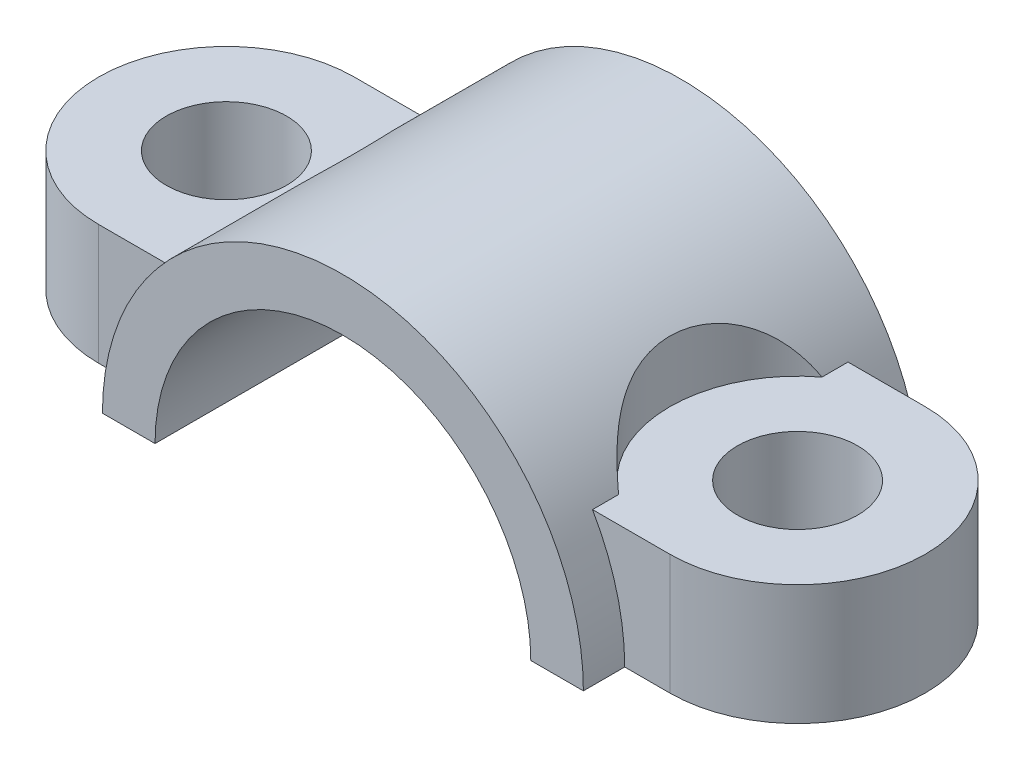
from build123d import *

# Parameters (mm, degrees)
SKETCH_4_R          = 8.5
SKETCH_4_R_2        = 4
EXTRUDE_1_DEPTH     = 8
EXTRUDE_1_2_DEPTH   = 8
SKETCH_5_R          = 12.5
CUT_EXTRUDE_1_DEPTH = 10
EXTRUDE_3_DEPTH     = 11.25
SKETCH_7_R          = 8.5
CUT_EXTRUDE_2_DEPTH = 31.770318642
EXTRUDE_START       = -8
EXTRUDE_4_DEPTH     = 8
SKETCH_9_R          = 4
CUT_EXTRUDE_3_DEPTH = 31.770318642


with BuildPart() as part:
    # 草图4 → 凸台-拉伸1 (new body)
    with BuildSketch(Plane(origin=(0, 0, 0), x_dir=(1, 0, 0), z_dir=(0, 1, 0))):
        with Locations(Location((-19, 0, 0), (0, 0, 270))):
            Circle(SKETCH_4_R)
        with Locations(Location((-19, 0, 0), (0, 0, 270))):
            Circle(SKETCH_4_R_2, mode=Mode.SUBTRACT)
    extrude(amount=EXTRUDE_1_DEPTH)


with BuildPart() as body_2:
    # 草图4 → Extrude 1 2 (new body)
    with BuildSketch(Plane(origin=(0, 0, 0), x_dir=(1, 0, 0), z_dir=(0, 1, 0))):
        with Locations(Location((19, 0, 0), (0, 0, 90))):
            Circle(SKETCH_4_R)
        with Locations(Location((19, 0, 0), (0, 0, 90))):
            Circle(SKETCH_4_R_2, mode=Mode.SUBTRACT)
    extrude(amount=EXTRUDE_1_2_DEPTH)


with BuildPart() as cut_extrude_1_tool:
    # 草图5 → 切除-拉伸1 (new, symmetric)
    with BuildSketch(Plane.XY):
        Circle(SKETCH_5_R)
    extrude(amount=CUT_EXTRUDE_1_DEPTH, both=True)


with BuildPart() as part_1:
    add(part.part)

    # 切除-拉伸1: cut by cut_extrude_1_tool
    add(cut_extrude_1_tool.part, mode=Mode.SUBTRACT)



with BuildPart() as body_2_1:
    add(body_2.part)

    # 切除-拉伸1: cut by cut_extrude_1_tool
    add(cut_extrude_1_tool.part, mode=Mode.SUBTRACT)


with BuildPart() as part_2:
    add(part_1.part)

    add(body_2_1.part)  # 凸台-拉伸3 merges body 2
    # 草图6 → 凸台-拉伸3 (add, symmetric)
    with BuildSketch(Plane.XY):
        with BuildLine():
            Line((-16, 0), (-12.5, 0))
            ThreePointArc((-12.5, 0), (0, 12.5), (12.5, 0))
            Line((12.5, 0), (16, 0))
            ThreePointArc((16, 0), (0, 16), (-16, 0))
        make_face()
    extrude(amount=EXTRUDE_3_DEPTH, both=True)

    # 草图7 → 切除-拉伸2 (cut, through all)
    with BuildSketch(Plane(origin=(0, 8, 0), x_dir=(1, 0, 0), z_dir=(0, 1, 0))):
        with Locations((-19, 0)):
            Circle(SKETCH_7_R)
    cut_extrude_2 = extrude(amount=CUT_EXTRUDE_2_DEPTH, mode=Mode.SUBTRACT)

    # 草图8 → 凸台-拉伸4 (add)
    with BuildSketch(Plane(origin=(0, 8, 0), x_dir=(1, 0, 0), z_dir=(0, 1, 0)).offset(EXTRUDE_START)):
        with BuildLine():
            Line((-19, -8.5), (-19, -4))
            ThreePointArc((-19, -4), (-15, 0), (-19, 4))
            Line((-19, 4), (-19, 8.5))
            Line((-19, 8.5), (-13.461758669, 8.5))
            Line((-13.461758669, 8.5), (-13.461758669, -8.5))
            Line((-13.461758669, -8.5), (-19, -8.5))
        make_face()
    extrude_4 = extrude(amount=EXTRUDE_4_DEPTH)

    # 草图9 → 切除-拉伸3 (cut, through all)
    with BuildSketch(Plane(origin=(0, 8, 0), x_dir=(1, 0, 0), z_dir=(0, 1, 0))):
        with Locations(Location((-19, 0, 0), (0, 0, 270))):
            Circle(SKETCH_9_R)
    cut_extrude_3 = extrude(amount=-CUT_EXTRUDE_3_DEPTH, mode=Mode.SUBTRACT)

    # 镜向1: 切除-拉伸2, 凸台-拉伸4, 切除-拉伸3 across plane
    add(cut_extrude_2.mirror(Plane(origin=(0, 0, 0), x_dir=(0, 0, 1), z_dir=(1, 0, 0))), mode=Mode.SUBTRACT)
    add(extrude_4.mirror(Plane(origin=(0, 0, 0), x_dir=(0, 0, 1), z_dir=(1, 0, 0))))
    add(cut_extrude_3.mirror(Plane(origin=(0, 0, 0), x_dir=(0, 0, 1), z_dir=(1, 0, 0))), mode=Mode.SUBTRACT)


solid = part_2.part
